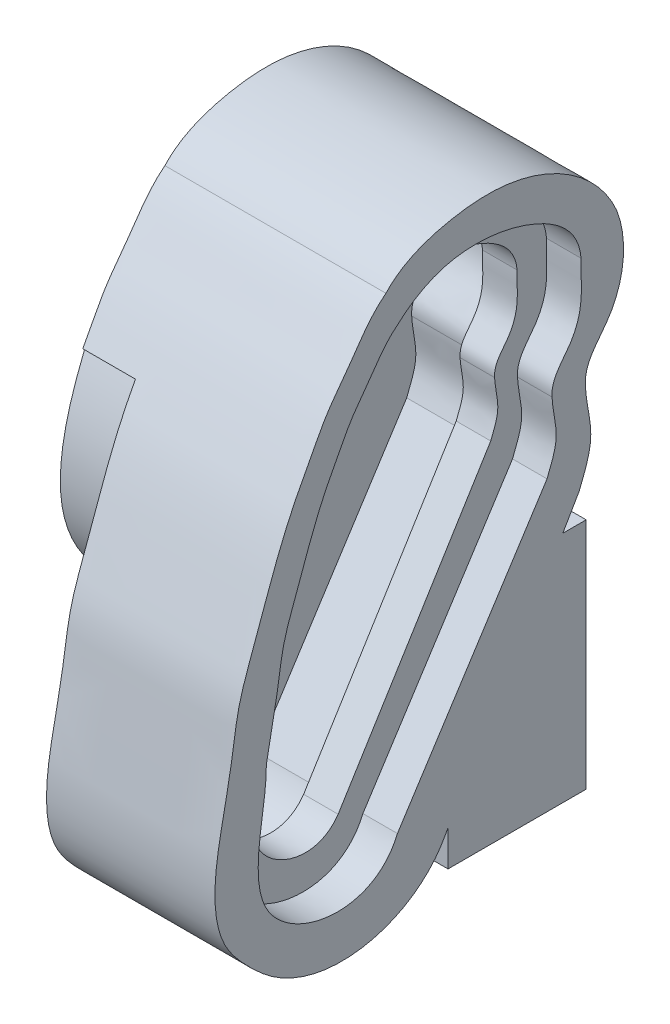
from build123d import *

# Parameters (mm, degrees)
BOSS_EXTRUDE1_DEPTH = 32.004
CUT_EXTRUDE1_REACH  = 52.651
SKETCH2_W           = 10.16
SKETCH2_H           = 33.782
BOSS_EXTRUDE2_DEPTH = 32.004
CUT_EXTRUDE12_DEPTH = 7.62
CUT_EXTRUDE2_DEPTH  = 20.32
BOSS_EXTRUDE3_START = -5
BOSS_EXTRUDE3_DEPTH = 5


with BuildPart() as part:
    # Sketch1 → Boss-Extrude1 (new body)
    with BuildSketch(Plane(origin=(0, 0, 0), x_dir=(0, 0, -1), z_dir=(1, 0, 0))):
        Polygon((-4.732014174, 33.782), (-20, 5.418691194), (-20, 0), (0, 0), (0, 33.782), align=None)
    extrude(amount=BOSS_EXTRUDE1_DEPTH)

    # Cut-Extrude1: up to this face of the body (flat: up to its plane)
    cut_extrude1_end = Plane(part.part.faces().sort_by_distance((16.002, 16.891, 0))[0])
    # Sketch2 → Cut-Extrude1 (cut, up to the picked face)
    with BuildSketch(Plane.XY.offset(20), mode=Mode.PRIVATE) as cut_extrude1_sk1:
        with Locations((5.08, 16.891)):
            Rectangle(SKETCH2_W, SKETCH2_H)
    cut_extrude1_tool1 = split(extrude(cut_extrude1_sk1.sketch, amount=-CUT_EXTRUDE1_REACH, mode=Mode.PRIVATE), bisect_by=cut_extrude1_end, keep=Keep.BOTH, mode=Mode.PRIVATE)
    add(cut_extrude1_tool1.solids().sort_by(Axis((5.08, 16.891, 20), (0, 0, -1)))[0], mode=Mode.SUBTRACT)

    # Sketch3 → Boss-Extrude2 (add)
    with BuildSketch(Plane(origin=(32.004, 0, 0), x_dir=(0, 0, -1), z_dir=(1, 0, 0))):
        with BuildLine():
            Line((-1.041898894, 37.819580352), (-20.425711142, 4.411090913))
            add(Edge.make_bspline(
                [(-28.990863836, 76.679566769), (-31.232909677, 74.963719394), (-33.732986061, 70.824046309), (-37.497488492, 66.146643328), (-39.903331702, 61.429974823), (-42.227249866, 57.237506184), (-44.264088565, 52.548597794), (-46.05323836, 47.844583103), (-47.992437862, 42.1579016), (-50.384170128, 36.189996989), (-51.220303167, 29.366981059), (-52.655170076, 22.189775957), (-54.213682593, 14.431567117), (-53.15830488, 7.026285239), (-49.148965955, 2.31590937), (-44.79921519, -1.676054926), (-34.11386062, -5.760372433), (-23.821242659, -1.917513673), (-20.425711142, 4.411090913)],
                knots=[0, 0, 0, 0, 0.072421421, 0.125935126, 0.156714978, 0.210822466, 0.251531751, 0.290505409, 0.342631637, 0.409160701, 0.457774769, 0.521962877, 0.600975597, 0.665386784, 0.707931619, 0.760162571, 0.818986836, 1, 1, 1, 1], degree=3))
            add(Edge.make_bspline(
                [(-28.990863836, 76.679566769), (-26.73915408, 79.112921518), (-21.030742263, 81.270725831), (-12.538111975, 82.115504651), (-2.921638676, 79.64030996), (2.641856903, 74.520771533), (4.443590479, 70.328501388)],
                knots=[0, 0, 0, 0, 0.249519018, 0.456679629, 0.650574559, 1, 1, 1, 1], degree=3))
            add(Edge.make_bspline(
                [(4.443590479, 70.328501388), (5.485412236, 67.575284923), (5.828654597, 62.918883351), (3.036246508, 56.307424272), (-0.345943135, 53.564728338), (-0.103264622, 50.585006456)],
                knots=[0, 0, 0, 0, 0.417925378, 0.63028688, 1, 1, 1, 1], degree=3))
            add(Edge.make_bspline(
                [(-0.103264622, 50.585006456), (-0.03002506, 48.278361066), (1.510266083, 43.840190855), (-0.319410934, 39.609766892), (-1.041898894, 37.819580352)],
                knots=[0, 0, 0, 0, 0.545479048, 1, 1, 1, 1], degree=3))
        make_face()
    extrude(amount=-BOSS_EXTRUDE2_DEPTH)

    # Sketch12 → Cut-Extrude12 (cut)
    with BuildSketch(Plane.ZY):
        with BuildLine():
            Line((0, 26.862215059), (30.459028531, 27.75351096))
            add(Edge.make_bspline(
                [(40.540498558, 59.665431577), (42.909831582, 53.83996772), (47.203899009, 40.158439503), (37.550828376, 28.181402423), (30.459028531, 27.75351096)],
                knots=[0, 0, 0, 0, 0.503129754, 1, 1, 1, 1], degree=3))
            Line((40.540498558, 59.665431577), (76.573173661, 59.665431577))
            Line((76.573173661, 59.665431577), (73.088020989, 4.288989124))
            Line((73.088020989, 4.288989124), (73.088020989, -7.736217608))
            Line((73.088020989, -7.736217608), (0, -7.736217608))
            Line((0, -7.736217608), (0, 26.862215059))
        make_face()
    extrude(amount=-CUT_EXTRUDE12_DEPTH, mode=Mode.SUBTRACT)

    # Sketch5 → Cut-Extrude2 (cut)
    with BuildSketch(Plane(origin=(32.004, 0, 0), x_dir=(0, 0, -1), z_dir=(1, 0, 0))):
        with BuildLine():
            Line((-5.664837482, 41.745342922), (-27.325285312, 8.108645689))
            add(Edge.make_bspline(
                [(-46.311975998, 26.19500301), (-46.125532675, 21.127665365), (-52.709326785, 3.600668927), (-30.784695613, -0.178334535), (-27.325285312, 8.108645689)],
                knots=[0, 0, 0, 0, 0.459344729, 1, 1, 1, 1], degree=3))
            add(Edge.make_bspline(
                [(-27.325285312, 71.861832394), (-29.062870038, 70.532055037), (-31.000432448, 67.323790921), (-33.917914943, 63.698841095), (-35.782459661, 60.043334686), (-37.583409495, 56.794643491), (-39.16223212, 53.159256), (-40.547816815, 49.519120751), (-42.056189385, 45.082053585), (-43.885061142, 40.591441335), (-44.612387444, 34.871980073), (-45.132271214, 32.397284255), (-46.077195121, 27.494487314), (-46.311975998, 26.19500301)],
                knots=[0, 0, 0, 0, 0.068256101, 0.118691963, 0.147701511, 0.198697005, 0.237064895, 0.273796982, 0.322925168, 0.385627811, 0.431445839, 0.491942167, 0.516683456, 0.516683456, 0.516683456, 0.516683456], degree=3))
            add(Edge.make_bspline(
                [(-27.325285312, 71.861832394), (-25.453046782, 73.610588482), (-21.354694663, 76.081209311), (-14.505897286, 76.578700762), (-6.687450586, 74.924504871), (-1.086987564, 71.229601514), (-0.73650537, 66.939756724)],
                knots=[0, 0, 0, 0, 0.24280953, 0.435179431, 0.63194459, 1, 1, 1, 1], degree=3))
            add(Edge.make_bspline(
                [(-0.73650537, 66.939756724), (-0.820571538, 64.725253273), (-0.300092162, 61.1781981), (-2.525096206, 56.07102947), (-5.116468046, 53.948867186), (-4.937395921, 51.638548152)],
                knots=[0, 0, 0, 0, 0.415080878, 0.628480154, 1, 1, 1, 1], degree=3))
            add(Edge.make_bspline(
                [(-4.937395921, 51.638548152), (-4.880635261, 49.850897975), (-3.686909626, 46.411316061), (-5.104909313, 43.13273749), (-5.664837482, 41.745342922)],
                knots=[0, 0, 0, 0, 0.545479048, 1, 1, 1, 1], degree=3))
        make_face()
    extrude(amount=-CUT_EXTRUDE2_DEPTH, mode=Mode.SUBTRACT)

    # Sketch8 → Boss-Extrude3 (add)
    with BuildSketch(Plane(origin=(32.004, 0, 0), x_dir=(0, 0, -1), z_dir=(1, 0, 0)).offset(BOSS_EXTRUDE3_START)):
        Polygon((-20.459178777, 78.898069241), (-27.130880675, 74.011668509), (-33.641818672, 67.383524943), (-40.718995311, 56.933871369), (-45.204034892, 44.153141227), (-47.484355234, 31.337102117), (-50.904835746, 17.818060092), (-49.19459549, 6.253578359), (-42.288326401, 1.576209305), (-30.905461519, -1.303792653), (-7.41998923, 33.373178401), (-2.203708451, 42.280510665), (-2.203708451, 50.55984247), (-0.476101772, 57.388002201), (1.474158401, 65.09617336), (-0.476101772, 74.011668509), (-8.816776546, 78.896105311), align=None)
        with BuildLine():
            Line((-8.816776546, 45.570502663), (-30.905461519, 9.815807516))
            add(Edge.make_bspline(
                [(-40.718995311, 33.373178401), (-41.714722873, 26.097012109), (-48.998338581, 9.288119288), (-33.497701184, 6.114941573), (-30.905461519, 9.815807516)],
                knots=[0, 0, 0, 0, 0.68648319, 1, 1, 1, 1], degree=3))
            add(Edge.make_bspline(
                [(-25.603623614, 68.910782004), (-26.950251751, 67.880185625), (-28.451862722, 65.393856833), (-30.712911432, 62.584357913), (-32.157934117, 59.751724033), (-33.553667416, 57.231938348), (-34.77726382, 54.420956187), (-35.851059216, 51.576067203), (-37.020226667, 48.267155194), (-38.436798007, 44.20270516), (-39.003056614, 41.644768047), (-38.808114271, 42.406416739), (-40.537040131, 34.380278737), (-40.718995311, 33.373178401)],
                knots=[0, 0, 0, 0, 0.068256101, 0.118691963, 0.147701511, 0.198697005, 0.237064895, 0.273796982, 0.322925168, 0.385627811, 0.431445839, 0.491942167, 0.516683456, 0.516683456, 0.516683456, 0.516683456], degree=3))
            add(Edge.make_bspline(
                [(-25.603623614, 68.910782004), (-24.152638753, 70.266067972), (-20.976415861, 72.180799115), (-15.668597893, 72.56635499), (-9.609301701, 71.284353174), (-5.268942859, 68.420803072), (-4.997319159, 65.09617336)],
                knots=[0, 0, 0, 0, 0.24280953, 0.435179431, 0.63194459, 1, 1, 1, 1], degree=3))
            add(Edge.make_bspline(
                [(-4.997319159, 65.09617336), (-5.062470439, 63.379933186), (-4.659098922, 60.630965426), (-6.383477057, 56.672909738), (-8.391790232, 55.028233968), (-8.253009336, 53.237736717)],
                knots=[0, 0, 0, 0, 0.415080878, 0.628480154, 1, 1, 1, 1], degree=3))
            add(Edge.make_bspline(
                [(-8.253009336, 53.237736717), (-8.209019824, 51.852307829), (-7.283882457, 49.186631846), (-8.382832215, 46.645733453), (-8.816776546, 45.570502663)],
                knots=[0, 0, 0, 0, 0.545479048, 1, 1, 1, 1], degree=3))
        make_face(mode=Mode.SUBTRACT)
    extrude(amount=-BOSS_EXTRUDE3_DEPTH)


solid = part.part
